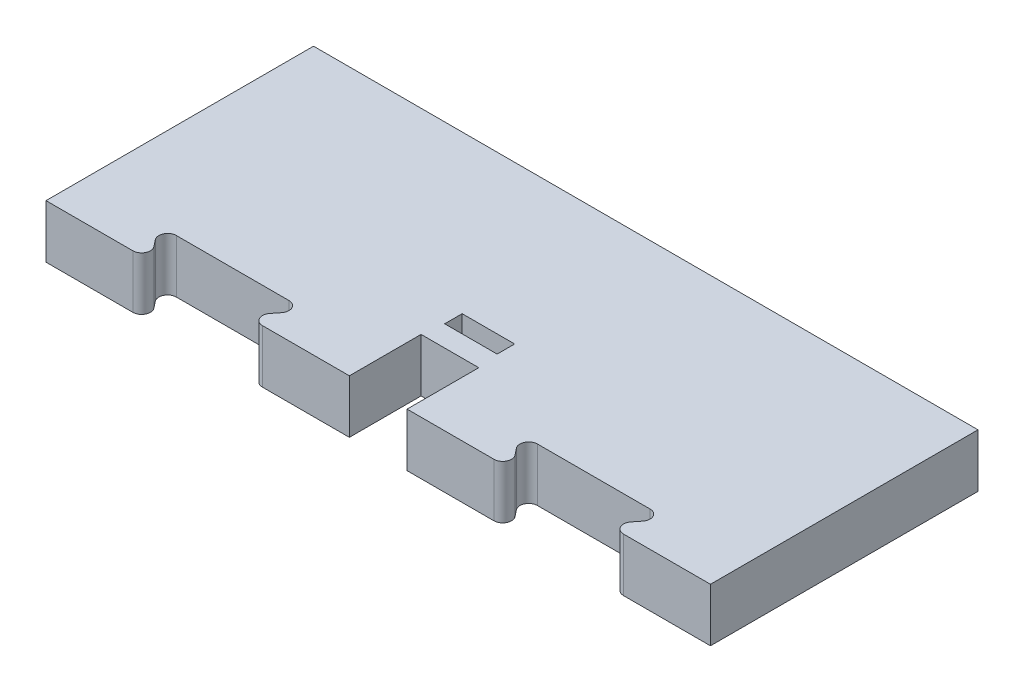
from build123d import *

# Parameters (mm, degrees)
SKETCH1_W           = 38
SKETCH1_H           = 8.3
BOSS_EXTRUDE1_DEPTH = 3.05
SKETCH3_W           = 3
SKETCH3_H           = 1
CUT_EXTRUDE2_DEPTH  = 40.015285466
CUT_EXTRUDE1_DEPTH  = 40.015285466
FILLET1_R           = 0.5
SKETCH4_W           = 38
SKETCH4_H           = 3.05
BOSS_EXTRUDE2_DEPTH = 7


with BuildPart() as part:
    # Sketch1 → Boss-Extrude1 (new body)
    with BuildSketch(Plane(origin=(0, 0, 0), x_dir=(1, 0, 0), z_dir=(0, 1, 0))):
        with Locations((19, 4.15)):
            Rectangle(SKETCH1_W, SKETCH1_H)
    extrude(amount=BOSS_EXTRUDE1_DEPTH)

    # Sketch3 → Cut-Extrude2 (cut, through all)
    with BuildSketch(Plane(origin=(0, 3.05, 0), x_dir=(1, 0, 0), z_dir=(0, 1, 0))):
        Polygon((20.65, 4.1), (19, 4.1), (17.35, 4.1), (17.35, 0), (20.65, 0), align=None)
        with Locations((19, 5.8)):
            Rectangle(SKETCH3_W, SKETCH3_H)
    extrude(amount=-CUT_EXTRUDE2_DEPTH, mode=Mode.SUBTRACT)

    # Sketch2 → Cut-Extrude1 (cut, through all)
    with BuildSketch(Plane(origin=(0, 3.05, 0), x_dir=(1, 0, 0), z_dir=(0, 1, 0))):
        Polygon((4.425, 2), (6, 0), (11.35, 0), (12.925, 2), align=None)
        Polygon((33.575, 2), (25.075, 2), (26.65, 0), (32, 0), align=None)
    extrude(amount=-CUT_EXTRUDE1_DEPTH, mode=Mode.SUBTRACT)

    # Fillet1
    fillet1_edges = [part.edges().sort_by_distance(p)[0] for p in [
        (12.925, 1.525, -2),
        (11.35, 1.525, 0),
        (6, 1.525, 0),
        (4.425, 1.525, -2),
        (33.575, 1.525, -2),
        (32, 1.525, 0),
        (26.65, 1.525, 0),
        (25.075, 1.525, -2),
    ]]
    fillet(fillet1_edges, radius=FILLET1_R)

    # Sketch4 → Boss-Extrude2 (add)
    with BuildSketch(Plane(origin=(0, 0, -8.3), x_dir=(-1, 0, 0), z_dir=(0, 0, -1))):
        with Locations((-19, 1.525)):
            Rectangle(SKETCH4_W, SKETCH4_H)
    extrude(amount=BOSS_EXTRUDE2_DEPTH)


solid = part.part
